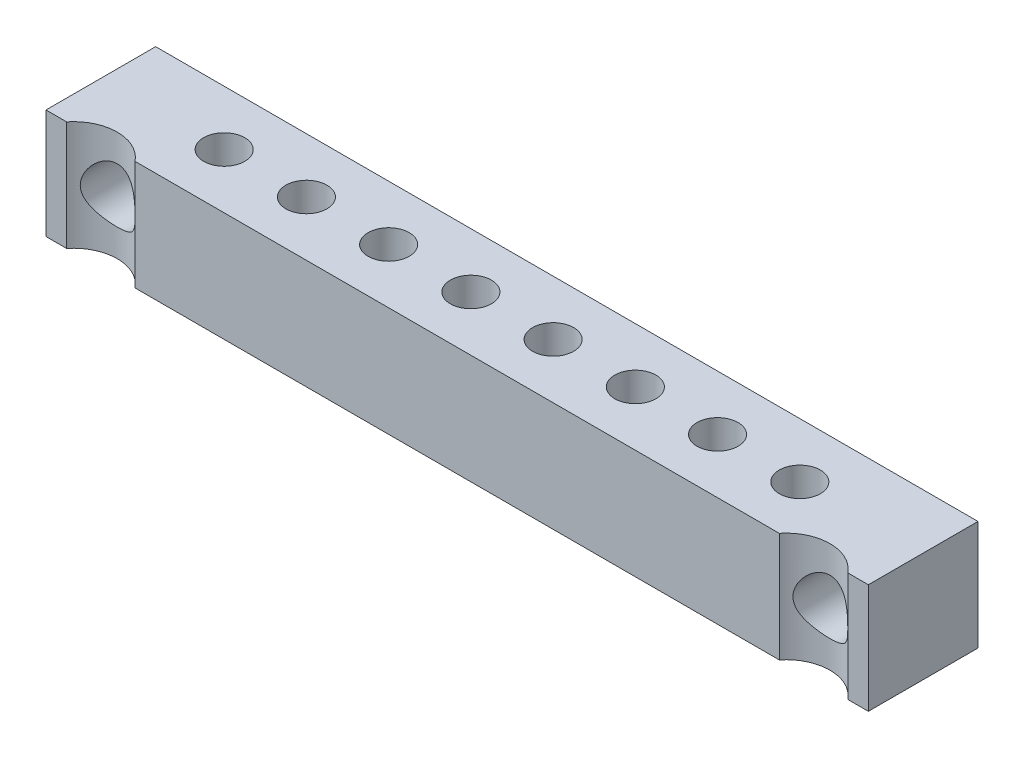
from build123d import *

# Parameters (mm, degrees)
CROQUIS1_W              = 30
CROQUIS1_H              = 4
CROQUIS1_R              = 1
SALIENTE_EXTRUIR1_DEPTH = 4
CROQUIS2_R              = 1.6
CROQUIS2_R_2            = 0.75
CORTAR_EXTRUIR1_DEPTH   = 4


with BuildPart() as part:
    # Croquis1 → Saliente-Extruir1 (new body)
    with BuildSketch(Plane.XY):
        with Locations((15, 2)):
            Rectangle(CROQUIS1_W, CROQUIS1_H)
        with Locations((2, 2)):
            Circle(CROQUIS1_R, mode=Mode.SUBTRACT)
        with Locations(Location((28, 2, 0), (0, 0, 180))):
            Circle(CROQUIS1_R, mode=Mode.SUBTRACT)
    extrude(amount=SALIENTE_EXTRUIR1_DEPTH)

    # Croquis2 → Cortar-Extruir1 (cut)
    with BuildSketch(Plane.XZ):
        with Locations((2, 5)):
            Circle(CROQUIS2_R)
        with Locations(Location((13.5, 2, 0), (0, 0, 270))):
            Circle(CROQUIS2_R_2)
        with Locations(Location((10.5, 2, 0), (0, 0, 270))):
            Circle(CROQUIS2_R_2)
        with Locations(Location((7.5, 2, 0), (0, 0, 270))):
            Circle(CROQUIS2_R_2)
        with Locations(Location((22.5, 2, 0), (0, 0, 90))):
            Circle(CROQUIS2_R_2)
        with Locations(Location((19.5, 2, 0), (0, 0, 90))):
            Circle(CROQUIS2_R_2)
        with Locations(Location((16.5, 2, 0), (0, 0, 90))):
            Circle(CROQUIS2_R_2)
        with Locations((28, 5)):
            Circle(CROQUIS2_R)
        with Locations(Location((25.5, 2, 0), (0, 0, 90))):
            Circle(CROQUIS2_R_2)
        with Locations(Location((4.5, 2, 0), (0, 0, 270))):
            Circle(CROQUIS2_R_2)
    extrude(amount=-CORTAR_EXTRUIR1_DEPTH, mode=Mode.SUBTRACT)


solid = part.part
